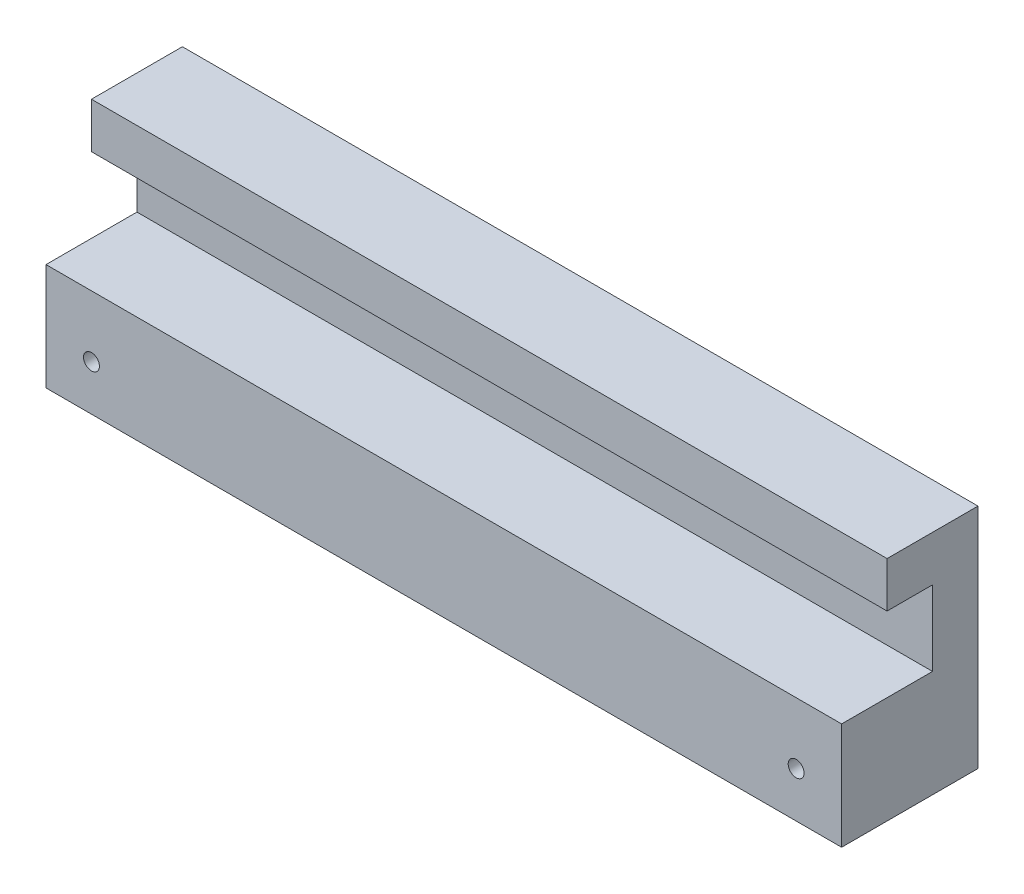
from build123d import *

# Parameters (mm, degrees)
SKETCH_1_W          = 35
SKETCH_1_H          = 10
EXTRUDE_1_DEPTH     = 2
SKETCH_3_W          = 35
SKETCH_3_H          = 2
EXTRUDE_2_DEPTH     = 2
SKETCH_3_3_W        = 35
SKETCH_3_3_H        = 4.7
EXTRUDE_3_DEPTH     = 4
SKETCH_4_R          = 0.35
CUT_EXTRUDE_1_DEPTH = 20.163767897


with BuildPart() as part:
    # 草图1 → 凸台-拉伸1 (new body)
    with BuildSketch(Plane.XY):
        Rectangle(SKETCH_1_W, SKETCH_1_H)
    extrude(amount=EXTRUDE_1_DEPTH)

    # 草图3 → 凸台-拉伸2 (add)
    with BuildSketch(Plane.XY.offset(2)):
        with Locations((0, 4)):
            Rectangle(SKETCH_3_W, SKETCH_3_H)
    extrude(amount=EXTRUDE_2_DEPTH)

    # 草图3<3> → 凸台-拉伸3 (add)
    with BuildSketch(Plane.XY.offset(2)):
        with Locations((0, -2.65)):
            Rectangle(SKETCH_3_3_W, SKETCH_3_3_H)
    extrude(amount=EXTRUDE_3_DEPTH)

    # 草图4 → 切除-拉伸1 (cut, through all)
    with BuildSketch(Plane.XY.offset(6)):
        with Locations((15.5, -3)):
            Circle(SKETCH_4_R)
        with Locations((-15.5, -3)):
            Circle(SKETCH_4_R)
    extrude(amount=-CUT_EXTRUDE_1_DEPTH, mode=Mode.SUBTRACT)


solid = part.part
